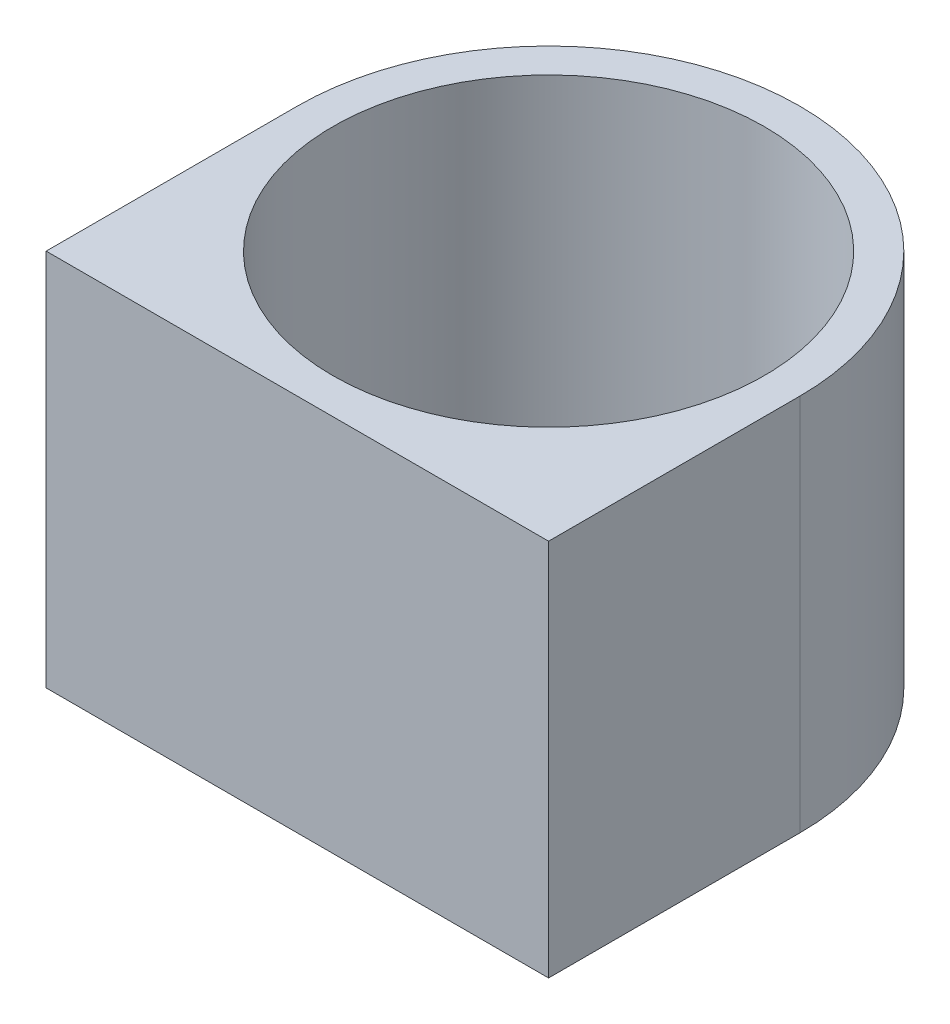
from build123d import *

# Parameters (mm, degrees)
SKETCH1_R           = 18.25
SKETCH1_R_2         = 1.6
SKETCH1_R_3         = 11.5
BOSS_EXTRUDE1_DEPTH = 2
SKETCH1_3_R         = 21.25
SKETCH1_3_R_2       = 18.25
BOSS_EXTRUDE2_DEPTH = 32
BOSS_EXTRUDE3_DEPTH = 32


with BuildPart() as part:
    # Sketch1 → Boss-Extrude1 (new body)
    with BuildSketch(Plane(origin=(0, 0, 0), x_dir=(1, 0, 0), z_dir=(0, 1, 0))):
        Circle(SKETCH1_R)
        with Locations((-14, 0)):
            Circle(SKETCH1_R_2, mode=Mode.SUBTRACT)
        with Locations((0, -14)):
            Circle(SKETCH1_R_2, mode=Mode.SUBTRACT)
        Circle(SKETCH1_R_3, mode=Mode.SUBTRACT)
        with Locations((14, 0)):
            Circle(SKETCH1_R_2, mode=Mode.SUBTRACT)
        with Locations((0, 14)):
            Circle(SKETCH1_R_2, mode=Mode.SUBTRACT)
    extrude(amount=BOSS_EXTRUDE1_DEPTH)

    # Sketch1<3> → Boss-Extrude2 (add)
    with BuildSketch(Plane(origin=(0, 0, 0), x_dir=(1, 0, 0), z_dir=(0, 1, 0))):
        Circle(SKETCH1_3_R)
        Circle(SKETCH1_3_R_2, mode=Mode.SUBTRACT)
    extrude(amount=BOSS_EXTRUDE2_DEPTH)

    # Sketch2 → Boss-Extrude3 (add)
    with BuildSketch(Plane(origin=(0, 0, 0), x_dir=(1, 0, 0), z_dir=(0, 1, 0))):
        with BuildLine():
            ThreePointArc((5.4e-08, -21.25), (-15.026019081, -15.026019119), (-21.25, 0))
            Line((-21.25, 0), (-21.25, -21.25))
            Line((-21.25, -21.25), (5.4e-08, -21.25))
        make_face()
        with BuildLine():
            Line((21.25, -21.25), (21.25, 0))
            ThreePointArc((21.25, 0), (15.026019119, -15.026019081), (5.4e-08, -21.25))
            Line((5.4e-08, -21.25), (21.25, -21.25))
        make_face()
    extrude(amount=BOSS_EXTRUDE3_DEPTH)


solid = part.part
